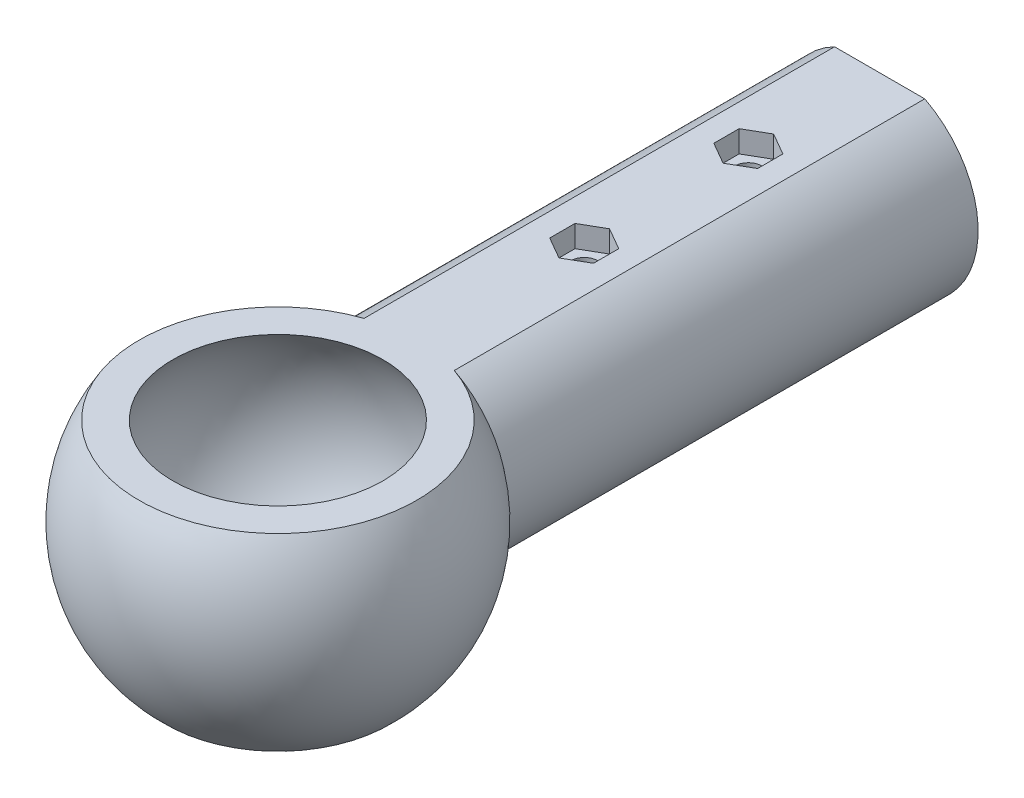
from build123d import *

# Parameters (mm, degrees)
BOSS_EXTRUDE2_DEPTH             = 40
BOSS_EXTRUDE2_DIRECTION_2_REACH = 37.299
SKETCH3_R                       = 3.25
CUT_EXTRUDE1_DEPTH              = 35
SKETCH4_R                       = 1.25
CUT_EXTRUDE3_DEPTH              = 2
CUT_EXTRUDE4_REACH              = 62.092
SKETCH4_3_R                     = 1.25


with BuildPart() as part:
    # Sketch1 → Revolve1 (revolve)
    with BuildSketch(Plane.XY):
        with BuildLine():
            Line((12.68857754, 8), (9.604686356, 8))
            ThreePointArc((9.604686356, 8), (12.27344014, -2.369106824), (5.937171044, -11))
            Line((5.937171044, -11), (10.198039027, -11))
            ThreePointArc((10.198039027, -11), (14.872770572, -1.949537258), (12.68857754, 8))
        make_face()
    revolve(axis=Axis((0, 10, 0), (0, -1, 0)))

    # Sketch2 → Boss-Extrude2 (add)
    with BuildSketch(Plane(origin=(0, 0, -15), x_dir=(-1, 0, 0), z_dir=(0, 0, -1))):
        with BuildLine():
            ThreePointArc((-4.123105626, 8), (0, -9), (4.123105626, 8))
            Line((4.123105626, 8), (-4.123105626, 8))
        make_face()
    extrude(amount=BOSS_EXTRUDE2_DEPTH)

    # Sketch2 → Boss-Extrude2 direction 2 (add, up to next)
    with BuildSketch(Plane(origin=(0, 0, -15), x_dir=(-1, 0, 0), z_dir=(0, 0, -1)), mode=Mode.PRIVATE) as boss_extrude2_direction_2_sk1:
        with BuildLine():
            ThreePointArc((-4.123105626, 8), (0, -9), (4.123105626, 8))
            Line((4.123105626, 8), (-4.123105626, 8))
        make_face()
    boss_extrude2_direction_2_tool1 = extrude(boss_extrude2_direction_2_sk1.sketch, amount=-BOSS_EXTRUDE2_DIRECTION_2_REACH, mode=Mode.PRIVATE) - part.part
    add(boss_extrude2_direction_2_tool1.solids().sort_by_distance((0, -0.187735, -15))[0])

    # Sketch3 → Cut-Extrude1 (cut)
    with BuildSketch(Plane(origin=(0, 0, -55), x_dir=(-1, 0, 0), z_dir=(0, 0, -1))):
        Circle(SKETCH3_R)
    extrude(amount=-CUT_EXTRUDE1_DEPTH, mode=Mode.SUBTRACT)

    # Sketch4 → Cut-Extrude3 (cut)
    # profile 1 of 2: a face of its own
    with BuildSketch(Plane(origin=(0, 8, 0), x_dir=(1, 0, 0), z_dir=(0, 1, 0))):
        Polygon((0, 40.690598923), (2, 41.845299462), (2, 44.154700538), (0, 45.309401077), (-2, 44.154700538), (-2, 41.845299462), align=None)
        with Locations((0, 43)):
            Circle(SKETCH4_R, mode=Mode.SUBTRACT)
    # profile 2 of 2: a face of its own
    with BuildSketch(Plane(origin=(0, 8, 0), x_dir=(1, 0, 0), z_dir=(0, 1, 0))):
        Polygon((0, 25.690598923), (2, 26.845299462), (2, 29.154700538), (0, 30.309401077), (-2, 29.154700538), (-2, 26.845299462), align=None)
        with Locations((0, 28)):
            Circle(SKETCH4_R, mode=Mode.SUBTRACT)
    extrude(amount=-CUT_EXTRUDE3_DEPTH, mode=Mode.SUBTRACT)

    # Sketch4<3> → Cut-Extrude4 (cut, up to next)
    with BuildSketch(Plane(origin=(0, 8, 0), x_dir=(1, 0, 0), z_dir=(0, 1, 0)), mode=Mode.PRIVATE) as cut_extrude4_sk1:
        with Locations((0, 43)):
            Circle(SKETCH4_3_R)
    cut_extrude4_tool1 = extrude(cut_extrude4_sk1.sketch, amount=-CUT_EXTRUDE4_REACH, mode=Mode.PRIVATE) & part.part
    # Sketch4<3> → Cut-Extrude4 (cut, up to next)
    with BuildSketch(Plane(origin=(0, 8, 0), x_dir=(1, 0, 0), z_dir=(0, 1, 0)), mode=Mode.PRIVATE) as cut_extrude4_sk2:
        with Locations((0, 28)):
            Circle(SKETCH4_3_R)
    cut_extrude4_tool2 = extrude(cut_extrude4_sk2.sketch, amount=-CUT_EXTRUDE4_REACH, mode=Mode.PRIVATE) & part.part
    add(cut_extrude4_tool1.solids().sort_by_distance((0, 8, -43))[0], mode=Mode.SUBTRACT)
    add(cut_extrude4_tool2.solids().sort_by_distance((0, 8, -28))[0], mode=Mode.SUBTRACT)


solid = part.part
